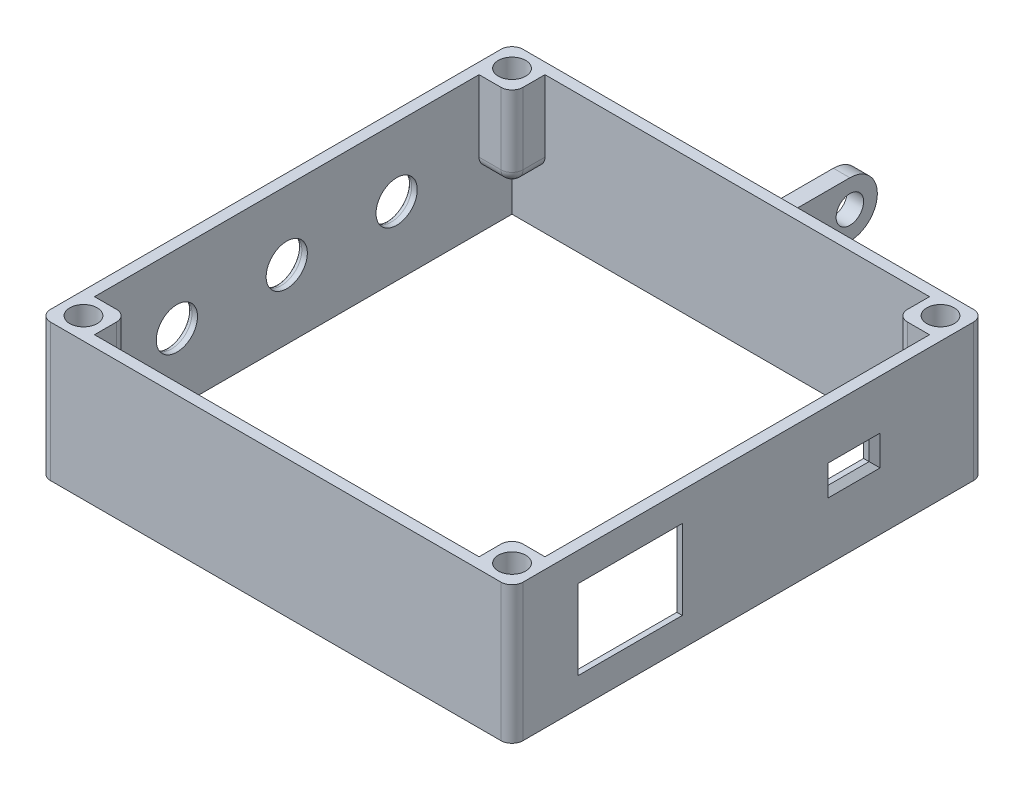
from build123d import *

# Parameters (mm, degrees)
SKETCH_1_W               = 86
SKETCH_1_H               = 86
SKETCH_1_W_2             = 82
SKETCH_1_H_2             = 82
EXTRUDE_1_DEPTH          = 25
CUT_EXTRUDE_1_DEPTH      = 100.347873656
CUT_EXTRUDE_1_DEPTH_BACK = 28
SKETCH_2_R               = 3.75
FILLET_1_R               = 1
SKETCH_4_W               = 7.5
SKETCH_4_H               = 3.5
SKETCH_4_W_2             = 19
SKETCH_4_H_2             = 14.5
CUT_EXTRUDE_2_DEPTH      = 28
CHAMFER_1_SIZE           = 1
CHAMFER_2_SIZE           = 1
FILLET_2_R               = 2
SKETCH_9_W               = 6
SKETCH_9_H               = 15
EXTRUDE_2_DEPTH          = 6
SKETCH_13_W              = 6
SKETCH_13_H              = 15
EXTRUDE_3_DEPTH          = 6
SKETCH_14_W              = 6
SKETCH_14_H              = 15
EXTRUDE_4_DEPTH          = 6
SKETCH_15_R              = 2.5
CUT_EXTRUDE_5_DEPTH      = 12
FILLET_3_R               = 2
SKETCH_16_W              = 30
SKETCH_16_H              = 15
EXTRUDE_5_DEPTH          = 2
CHAMFER_3_SIZE           = 1
EXTRUDE_6_DEPTH          = 1.5
SKETCH_20_R              = 2.5
CUT_EXTRUDE_6_DEPTH      = 83.645326547


with BuildPart() as part:
    # 草图1 → 凸台-拉伸1 (new body)
    with BuildSketch(Plane(origin=(0, 0, 0), x_dir=(1, 0, 0), z_dir=(0, 1, 0))):
        Rectangle(SKETCH_1_W, SKETCH_1_H)
        Rectangle(SKETCH_1_W_2, SKETCH_1_H_2, mode=Mode.SUBTRACT)
    extrude(amount=EXTRUDE_1_DEPTH)

    # 草图2 → 切除-拉伸1 (cut, two sides: drawn at the far end of the back side and taken through both)
    with BuildSketch(Plane.ZY.offset(43).offset(-CUT_EXTRUDE_1_DEPTH_BACK)):
        with Locations((0, 12.5)):
            Circle(SKETCH_2_R)
        with Locations((20, 12.5)):
            Circle(SKETCH_2_R)
        with Locations((-20, 12.5)):
            Circle(SKETCH_2_R)
    extrude(amount=CUT_EXTRUDE_1_DEPTH + CUT_EXTRUDE_1_DEPTH_BACK, mode=Mode.SUBTRACT)

    # 圆角1
    fillet_1_edges = [part.edges().sort_by_distance(p)[0] for p in [
        (-43, 12.5, 16.25),
        (-43, 12.5, -3.75),
        (-43, 12.5, -23.75),
    ]]
    fillet(fillet_1_edges, radius=FILLET_1_R)

    # 草图4 → 切除-拉伸2 (cut)
    with BuildSketch(Plane(origin=(43, 0, 0), x_dir=(0, 0, -1), z_dir=(1, 0, 0))):
        with Locations((19.25, 13.25)):
            Rectangle(SKETCH_4_W, SKETCH_4_H)
        with Locations((-21.5, 12.5)):
            Rectangle(SKETCH_4_W_2, SKETCH_4_H_2)
    extrude(amount=-CUT_EXTRUDE_2_DEPTH, mode=Mode.SUBTRACT)

    # 倒角1
    chamfer_1_edges = [part.edges().sort_by_distance(p)[0] for p in [
        (43, 11.5, -19.25),
        (43, 13.25, -23),
        (43, 15, -19.25),
        (43, 13.25, -15.5),
    ]]
    chamfer(chamfer_1_edges, length=CHAMFER_1_SIZE)

    # 倒角2
    chamfer_2_edges = [part.edges().sort_by_distance(p)[0] for p in [
        (41, 12.5, 12),
        (41, 19.75, 21.5),
        (41, 12.5, 31),
        (41, 5.25, 21.5),
    ]]
    chamfer(chamfer_2_edges, length=CHAMFER_2_SIZE)

    # 圆角2
    fillet_2_edges = [part.edges().sort_by_distance(p)[0] for p in [
        (-43, 12.5, 43),
        (-43, 12.5, -43),
        (43, 12.5, -43),
        (43, 12.5, 43),
    ]]
    fillet(fillet_2_edges, radius=FILLET_2_R)

    # 草图9 → 凸台-拉伸2 (add)
    with BuildSketch(Plane(origin=(-41, 0, 0), x_dir=(0, 0, -1), z_dir=(1, 0, 0))):
        with Locations((-38, 17.5)):
            Rectangle(SKETCH_9_W, SKETCH_9_H)
    extrude(amount=EXTRUDE_2_DEPTH)

    # 草图13 → 凸台-拉伸3 (add)
    with BuildSketch(Plane(origin=(-41, 0, 0), x_dir=(0, 0, -1), z_dir=(1, 0, 0))):
        with Locations((38, 17.5)):
            Rectangle(SKETCH_13_W, SKETCH_13_H)
    extrude(amount=EXTRUDE_3_DEPTH)

    # 草图14 → 凸台-拉伸4 (add)
    with BuildSketch(Plane.ZY.offset(-41)):
        with Locations((38, 17.5)):
            Rectangle(SKETCH_14_W, SKETCH_14_H)
        with Locations((-38, 17.5)):
            Rectangle(SKETCH_14_W, SKETCH_14_H)
    extrude(amount=EXTRUDE_4_DEPTH)

    # 草图15 → 切除-拉伸5 (cut)
    with BuildSketch(Plane(origin=(0, 25, 0), x_dir=(1, 0, 0), z_dir=(0, 1, 0))):
        with Locations((-39, 39)):
            Circle(SKETCH_15_R)
        with Locations((39, 39)):
            Circle(SKETCH_15_R)
        with Locations((39, -39)):
            Circle(SKETCH_15_R)
        with Locations((-39, -39)):
            Circle(SKETCH_15_R)
    extrude(amount=-CUT_EXTRUDE_5_DEPTH, mode=Mode.SUBTRACT)

    # 圆角3
    fillet_3_edges = [part.edges().sort_by_distance(p)[0] for p in [
        (38, 10, -35),
        (35, 10, -38),
        (35, 17.5, -35),
        (38, 10, 35),
        (35, 10, 38),
        (35, 17.5, 35),
        (-35, 17.5, -35),
        (-35, 17.5, 35),
        (-38, 10, 35),
        (-35, 10, 38),
        (-38, 10, -35),
        (-35, 10, -38),
    ]]
    fillet(fillet_3_edges, radius=FILLET_3_R)

    # 草图16 → 凸台-拉伸5 (add)
    with BuildSketch(Plane(origin=(0, 0, -43), x_dir=(-1, 0, 0), z_dir=(0, 0, -1))):
        with Locations((0, 12.5)):
            Rectangle(SKETCH_16_W, SKETCH_16_H)
    extrude(amount=EXTRUDE_5_DEPTH)

    # 倒角3
    chamfer_3_edges = [part.edges().sort_by_distance(p)[0] for p in [
        (0, 5, -45),
        (15, 12.5, -45),
        (-15, 12.5, -45),
        (0, 20, -45),
    ]]
    chamfer(chamfer_3_edges, length=CHAMFER_3_SIZE)

    # 草图19 → 凸台-拉伸6 (add, symmetric)
    with BuildSketch(Plane(origin=(0, 0, 0), x_dir=(0, 0, -1), z_dir=(1, 0, 0))):
        with BuildLine():
            Line((45, 17.5), (60, 17.5))
            ThreePointArc((60, 17.5), (65, 12.5), (60, 7.5))
            Line((60, 7.5), (45, 7.5))
            Line((45, 7.5), (45, 17.5))
        make_face()
    extrude(amount=EXTRUDE_6_DEPTH, both=True)

    # 草图20 → 切除-拉伸6 (cut, through all)
    with BuildSketch(Plane.ZY.offset(1.5)):
        with Locations((-60, 12.5)):
            Circle(SKETCH_20_R)
    extrude(amount=-CUT_EXTRUDE_6_DEPTH, mode=Mode.SUBTRACT)


solid = part.part
